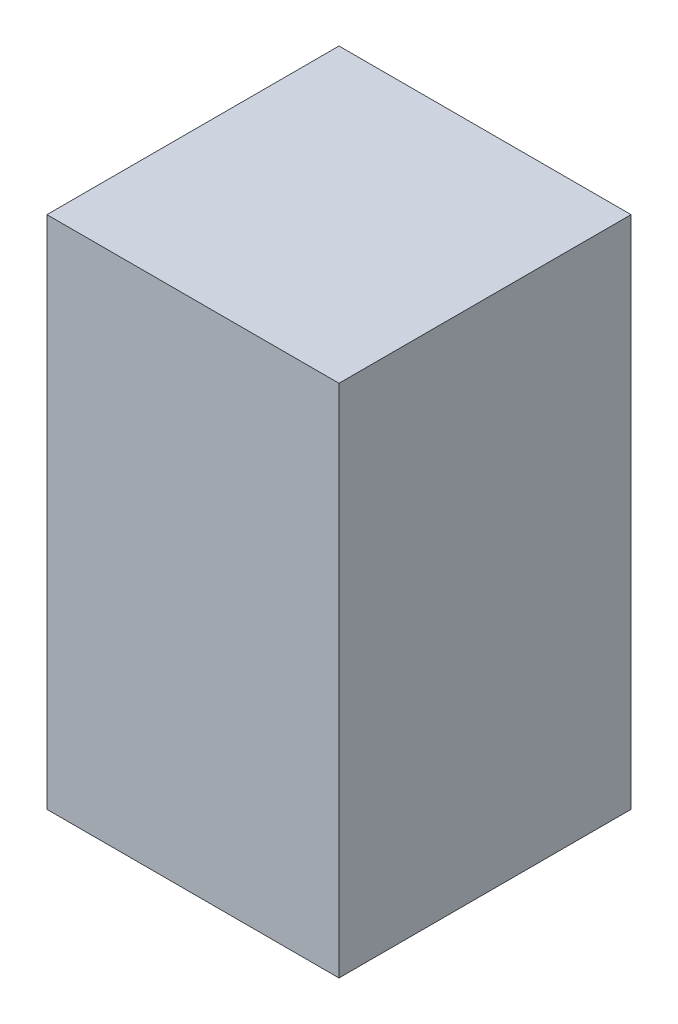
from build123d import *

# Parameters (mm, degrees)
SKETCH1_W           = 1219.2
SKETCH1_H           = 1219.2
BOSS_EXTRUDE1_DEPTH = 2150


with BuildPart() as part:
    # Sketch1 → Boss-Extrude1 (new body)
    with BuildSketch(Plane(origin=(0, 0, 0), x_dir=(1, 0, 0), z_dir=(0, 1, 0))):
        Rectangle(SKETCH1_W, SKETCH1_H)
    extrude(amount=BOSS_EXTRUDE1_DEPTH)


solid = part.part
